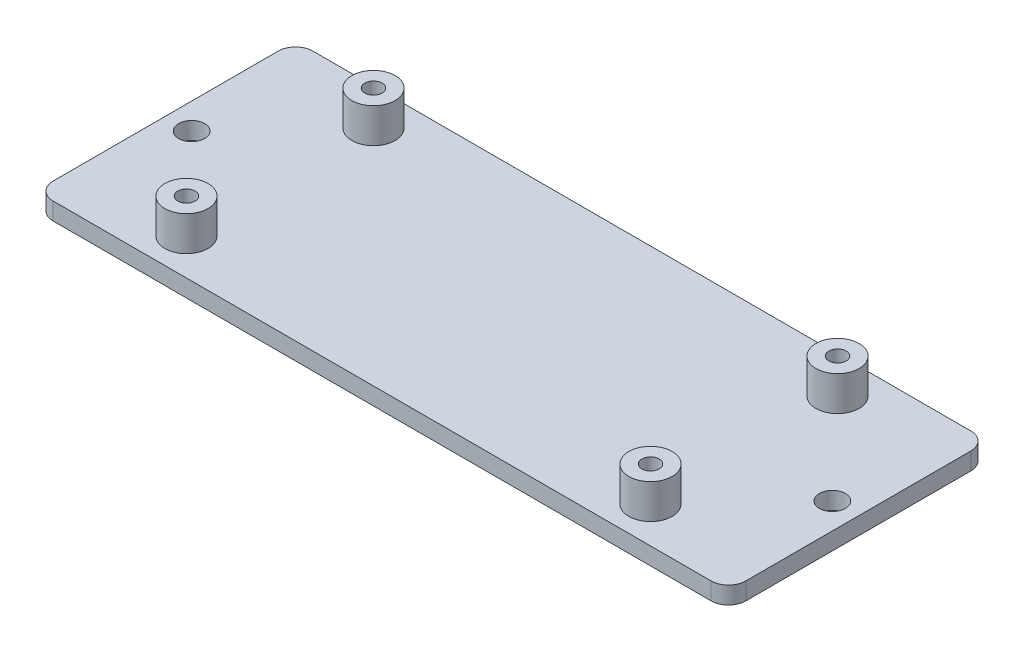
from build123d import *

# Parameters (mm, degrees)
BASE_R                 = 1.905
BOSS_EXTRUDEBASE_DEPTH = 2.54
STANDOFFS_R            = 3.175
STANDOFFS_R_2          = 1.27
BOSS_EXTRUDE2_DEPTH    = 5.08


with BuildPart() as part:
    # Base → Boss-ExtrudeBase (new body)
    with BuildSketch(Plane(origin=(0, 0, 0), x_dir=(1, 0, 0), z_dir=(0, 1, 0))):
        with BuildLine():
            Line((2.54, 0), (99.06, 0))
            ThreePointArc((99.06, 0), (100.856051224, 0.743948776), (101.6, 2.54))
            Line((101.6, 2.54), (101.6, 35.56))
            ThreePointArc((101.6, 35.56), (100.856051224, 37.356051224), (99.06, 38.1))
            Line((99.06, 38.1), (2.54, 38.1))
            ThreePointArc((2.54, 38.1), (0.743948776, 37.356051224), (0, 35.56))
            Line((0, 35.56), (0, 2.54))
            ThreePointArc((0, 2.54), (0.743948776, 0.743948776), (2.54, 0))
        make_face()
        with Locations(Location((3.81, 19.05, 0), (0, 0, 270))):
            Circle(BASE_R, mode=Mode.SUBTRACT)
        with Locations(Location((97.79, 19.05, 0), (0, 0, 90))):
            Circle(BASE_R, mode=Mode.SUBTRACT)
    extrude(amount=BOSS_EXTRUDEBASE_DEPTH)

    # Standoffs → Boss-Extrude2 (add)
    # profile 1 of 4: a face of its own
    with BuildSketch(Plane(origin=(0, 2.54, 0), x_dir=(1, 0, 0), z_dir=(0, 1, 0))):
        with Locations(Location((16.764, 32.766, 0), (0, 0, 90))):
            Circle(STANDOFFS_R)
        with Locations(Location((16.764, 32.766, 0), (0, 0, 270))):
            Circle(STANDOFFS_R_2, mode=Mode.SUBTRACT)
    # profile 2 of 4: a face of its own
    with BuildSketch(Plane(origin=(0, 2.54, 0), x_dir=(1, 0, 0), z_dir=(0, 1, 0))):
        with Locations(Location((84.836, 32.766, 0), (0, 0, 90))):
            Circle(STANDOFFS_R)
        with Locations(Location((84.836, 32.766, 0), (0, 0, 270))):
            Circle(STANDOFFS_R_2, mode=Mode.SUBTRACT)
    # profile 3 of 4: a face of its own
    with BuildSketch(Plane(origin=(0, 2.54, 0), x_dir=(1, 0, 0), z_dir=(0, 1, 0))):
        with Locations(Location((84.836, 5.334, 0), (0, 0, 90))):
            Circle(STANDOFFS_R)
        with Locations(Location((84.836, 5.334, 0), (0, 0, 270))):
            Circle(STANDOFFS_R_2, mode=Mode.SUBTRACT)
    # profile 4 of 4: a face of its own
    with BuildSketch(Plane(origin=(0, 2.54, 0), x_dir=(1, 0, 0), z_dir=(0, 1, 0))):
        with Locations(Location((16.764, 5.334, 0), (0, 0, 90))):
            Circle(STANDOFFS_R)
        with Locations(Location((16.764, 5.334, 0), (0, 0, 270))):
            Circle(STANDOFFS_R_2, mode=Mode.SUBTRACT)
    extrude(amount=BOSS_EXTRUDE2_DEPTH)


solid = part.part
